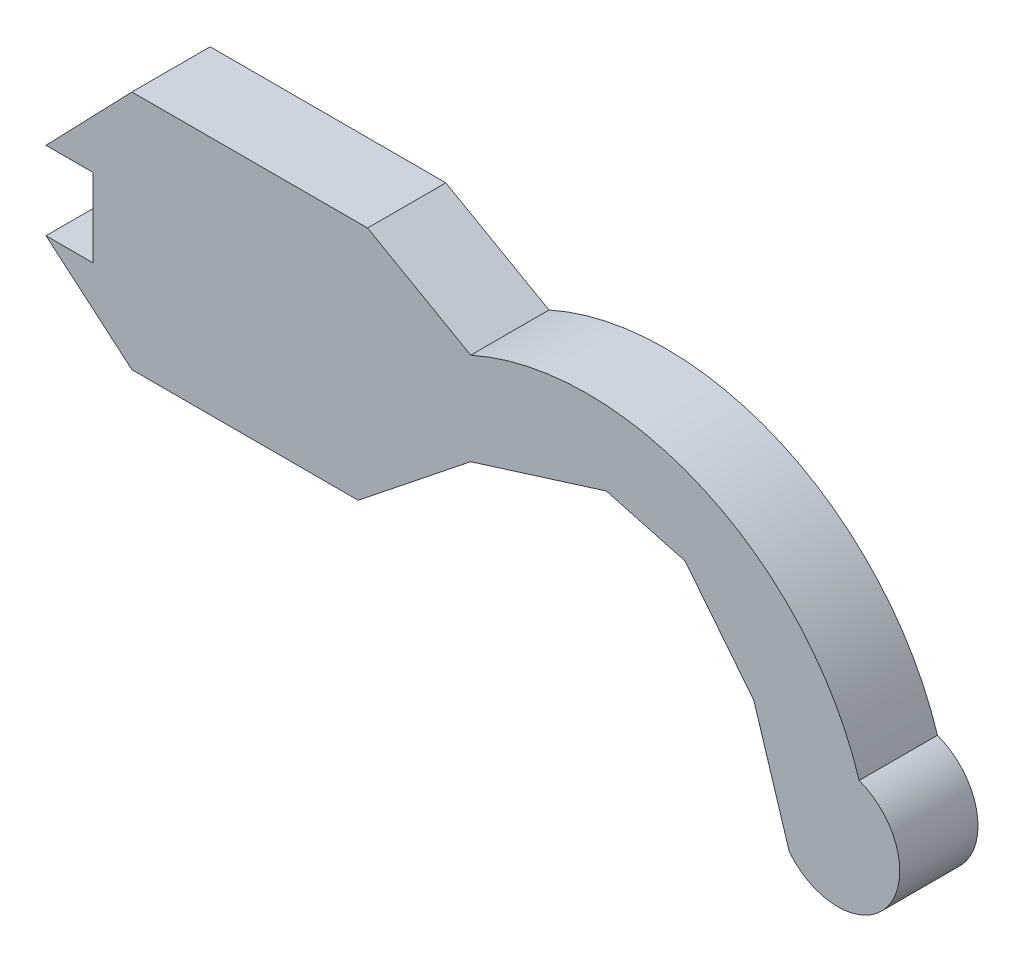
from build123d import *

# Parameters (mm, degrees)
BOSS_EXTRUDE1_DEPTH = 1.524


with BuildPart() as part:
    # Sketch1 → Boss-Extrude1 (new body)
    with BuildSketch(Plane.XY):
        with BuildLine():
            Line((8.880896155, 0), (7.962755207, 0))
            Line((7.962755207, 0), (9.635264959, -1.422689942))
            Line((9.635264959, -1.422689942), (14.039974044, -1.422689942))
            Line((14.039974044, -1.422689942), (16.231554776, 0.32393337))
            Line((16.231554776, 0.32393337), (18.872756066, 1.149856497))
            Line((18.872756066, 1.149856497), (20.404642344, 0.736894933))
            Line((20.404642344, 0.736894933), (21.744548774, -0.944356596))
            Line((21.744548774, -0.944356596), (22.435346644, -3.153443817))
            ThreePointArc((22.435346644, -3.153443817), (24.356473743, -3.107008643), (23.795164322, -1.269124727))
            ThreePointArc((23.795164322, -1.269124727), (20.773869568, 2.122690239), (16.231554776, 2.120028069))
            Line((16.231554776, 2.120028069), (14.223210267, 3.260079698))
            Line((14.223210267, 3.260079698), (9.635264959, 3.260079698))
            Line((9.635264959, 3.260079698), (7.962755207, 1.524))
            Line((7.962755207, 1.524), (8.880896155, 1.524))
            Line((8.880896155, 1.524), (8.880896155, 0))
        make_face()
    extrude(amount=BOSS_EXTRUDE1_DEPTH)


solid = part.part
